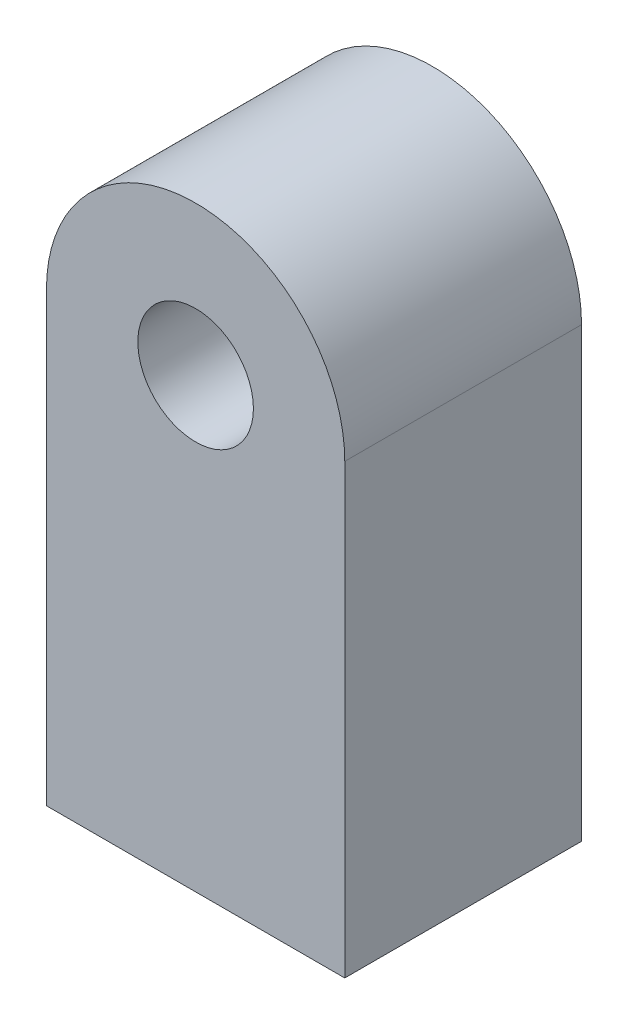
from build123d import *

# Parameters (mm, degrees)
SKETCH1_R           = 1.55
BOSS_EXTRUDE1_DEPTH = 6.35


with BuildPart() as part:
    # Sketch1 → Boss-Extrude1 (new body)
    with BuildSketch(Plane.XY):
        with BuildLine():
            Line((-4, 0), (4, 0))
            Line((4, 0), (4, 12))
            ThreePointArc((4, 12), (0, 16), (-4, 12))
            Line((-4, 12), (-4, 0))
        make_face()
        with Locations((0, 12)):
            Circle(SKETCH1_R, mode=Mode.SUBTRACT)
    extrude(amount=BOSS_EXTRUDE1_DEPTH)


solid = part.part
